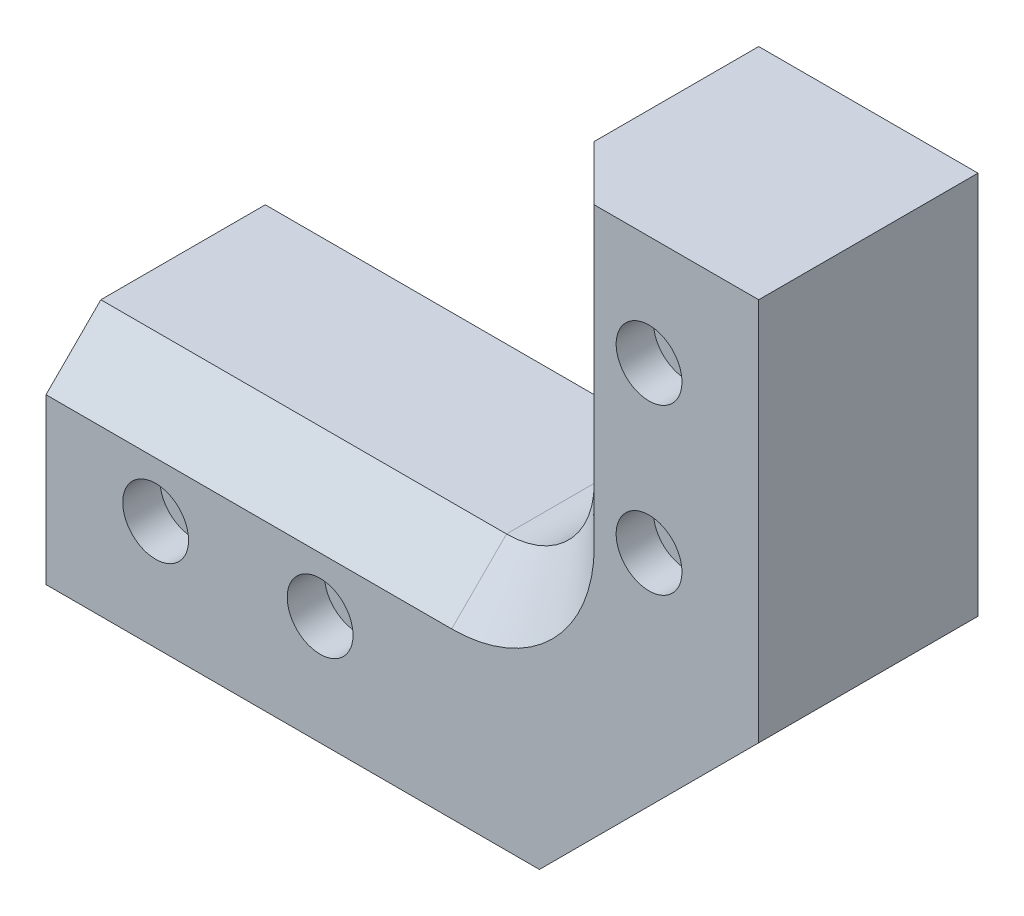
from build123d import *

# Parameters (mm, degrees)
BOSS_EXTRUDE1_DEPTH                                  = 20
CBORE_FOR_M3_HEXAGON_SOCKET_HEAD_CAP_SCR_D           = 3.2
CBORE_FOR_M3_HEXAGON_SOCKET_HEAD_CAP_SCR_CBORE_D     = 6
CBORE_FOR_M3_HEXAGON_SOCKET_HEAD_CAP_SCR_CBORE_DEPTH = 3.4
FILLET1_R                                            = 8
CHAMFER1_SIZE                                        = 20
M6_TAPPED_HOLE1_D                                    = 5
M6_TAPPED_HOLE1_CSINK_D                              = 6.05
M6_TAPPED_HOLE1_CSINK_ANGLE                          = 90
CHAMFER2_SIZE                                        = 5


with BuildPart() as part:
    # Sketch1 → Boss-Extrude1 (new body)
    with BuildSketch(Plane.XY):
        Polygon((0, 0), (-45, 0), (-45, -20), (20, -20), (20, 35), (0, 35), align=None)
    extrude(amount=BOSS_EXTRUDE1_DEPTH)

    # CBORE for M3 Hexagon socket head cap screws1 (through all)
    with Locations(Plane.XY.offset(20)):
        with Locations((-35, -10), (-20, -10), (10, 25), (10, 10)):
            CounterBoreHole(CBORE_FOR_M3_HEXAGON_SOCKET_HEAD_CAP_SCR_D / 2, CBORE_FOR_M3_HEXAGON_SOCKET_HEAD_CAP_SCR_CBORE_D / 2, CBORE_FOR_M3_HEXAGON_SOCKET_HEAD_CAP_SCR_CBORE_DEPTH)

    # Fillet1
    fillet1_edges = [part.edges().sort_by_distance(p)[0] for p in [
        (0, 0, 10),
    ]]
    fillet(fillet1_edges, radius=FILLET1_R)

    # Chamfer1
    chamfer1_edges = [part.edges().sort_by_distance(p)[0] for p in [
        (20, -20, 10),
    ]]
    chamfer(chamfer1_edges, length=CHAMFER1_SIZE)

    # M6 Tapped Hole1 (through all)
    with Locations(Plane(origin=(10, -10, 0), x_dir=(-0.7071067811865495, -0.7071067811865457, 0), z_dir=(0.7071067811865457, -0.7071067811865495, 0))):
        with Locations((0, -10)):
            CounterSinkHole(M6_TAPPED_HOLE1_D / 2, M6_TAPPED_HOLE1_CSINK_D / 2, counter_sink_angle=M6_TAPPED_HOLE1_CSINK_ANGLE)

    # Chamfer2
    chamfer2_edges = [part.edges().sort_by_distance(p)[0] for p in [
        (0, 21.5, 20),
        (-26.5, 0, 20),
        (-2.343145751, 2.343145751, 20),
    ]]
    chamfer(chamfer2_edges, length=CHAMFER2_SIZE)


solid = part.part
